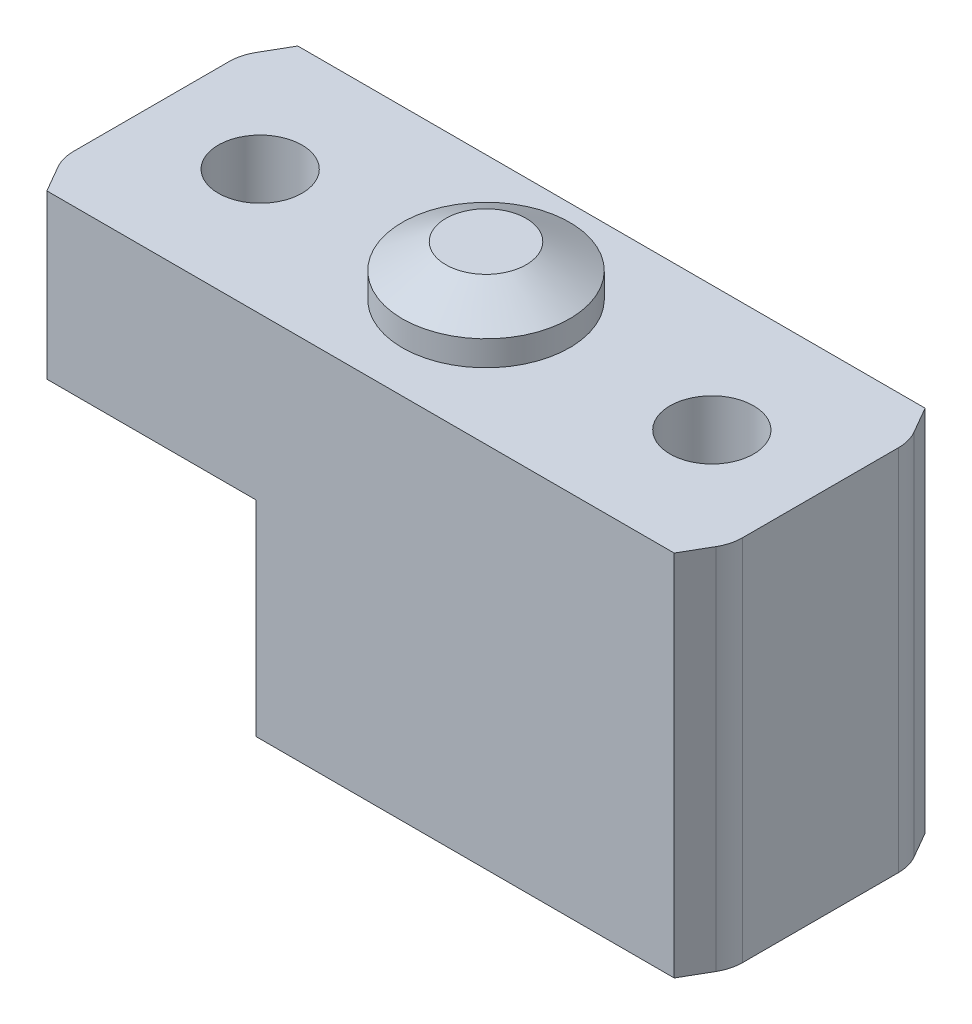
from build123d import *
from OCP.BRepFilletAPI import BRepFilletAPI_MakeChamfer
from build123d.topology import SkipClean

# Parameters (mm, degrees)
SKETCH1_W           = 8
SKETCH1_H           = 3
BOSS_EXTRUDE1_DEPTH = 2.2
SKETCH2_R           = 1
BOSS_EXTRUDE2_DEPTH = 0.6
SKETCH3_R           = 0.5
CUT_EXTRUDE1_DEPTH  = 2.5
SKETCH4_W           = 5.5
SKETCH4_H           = 3
BOSS_EXTRUDE3_DEPTH = 2.2
BOSS_EXTRUDE4_START = 0.6
SKETCH5_R           = 1
BOSS_EXTRUDE4_DEPTH = 0.6
CUT_EXTRUDE2_START  = -2.5
SKETCH6_R           = 0.5
CUT_EXTRUDE2_DEPTH  = 2.5
CHAMFER1_SIZE       = 0.25
CHAMFER1_SIZE2      = 0.433012702
FILLET1_R           = 0.5
CHAMFER2_SIZE       = 0.3
CHAMFER2_SIZE2      = 0.519615242


with BuildPart() as part:
    # Sketch1 → Boss-Extrude1 (new body)
    with BuildSketch(Plane(origin=(0, 0, 0), x_dir=(1, 0, 0), z_dir=(0, 1, 0))):
        with Locations((4, -1.5)):
            Rectangle(SKETCH1_W, SKETCH1_H)
    extrude(amount=BOSS_EXTRUDE1_DEPTH)

    # Sketch2 → Boss-Extrude2 (add)
    with BuildSketch(Plane(origin=(0, 2.2, 0), x_dir=(1, 0, 0), z_dir=(0, 1, 0))):
        with Locations(Location((4, -1.5, 0), (0, 0, 270))):
            Circle(SKETCH2_R)
    extrude(amount=BOSS_EXTRUDE2_DEPTH)

    # Sketch3 → Cut-Extrude1 (cut)
    with BuildSketch(Plane(origin=(0, 2.2, 0), x_dir=(1, 0, 0), z_dir=(0, 1, 0))):
        with Locations(Location((1.3, -1.5, 0), (0, 0, 270))):
            Circle(SKETCH3_R)
        with Locations(Location((6.7, -1.5, 0), (0, 0, 270))):
            Circle(SKETCH3_R)
    extrude(amount=-CUT_EXTRUDE1_DEPTH, mode=Mode.SUBTRACT)

    # Sketch4 → Boss-Extrude3 (add)
    with BuildSketch(Plane.XZ):
        with Locations((5.25, 1.5)):
            Rectangle(SKETCH4_W, SKETCH4_H)
    extrude(amount=BOSS_EXTRUDE3_DEPTH)

    # Sketch5 → Boss-Extrude4 (add)
    with BuildSketch(Plane.XZ.offset(2.2).offset(BOSS_EXTRUDE4_START)):
        with Locations(Location((4, 1.5, 0), (0, 0, 90))):
            Circle(SKETCH5_R)
    extrude(amount=-BOSS_EXTRUDE4_DEPTH)

    # Sketch6 → Cut-Extrude2 (cut)
    with SkipClean():  # the faces are left unmerged after this step: merging them gives an invalid solid
        with BuildSketch(Plane.XZ.offset(2.2).offset(CUT_EXTRUDE2_START)):
            with Locations(Location((6.7, 1.5, 0), (0, 0, 270))):
                Circle(SKETCH6_R)
        extrude(amount=CUT_EXTRUDE2_DEPTH, mode=Mode.SUBTRACT)

    # Chamfer1: one chamfer whose edges measure the first distance from different faces: ONE call of the kernel's chamfer builder (chamfer() names one face for all edges)
    chamfer1_edges_1 = [part.edges().sort_by_distance(p)[0] for p in [
        (1.25, 0, 0),
        (2.5, -1.1, 0),
        (0, 1.1, 0),
        (8, 0, 0),
    ]]
    chamfer1_side_1 = [part.faces().sort_by_distance(p)[0] for p in [
        (4.509259259, 0.203703704, 0),
    ]]
    chamfer1_edges_2 = [part.edges().sort_by_distance(p)[0] for p in [
        (2.5, -1.1, 3),
        (1.25, 0, 3),
        (8, 0, 3),
        (0, 1.1, 3),
    ]]
    chamfer1_side_2 = [part.faces().sort_by_distance(p)[0] for p in [
        (4.509259259, 0.203703704, 3),
    ]]
    chamfer1 = BRepFilletAPI_MakeChamfer(part.part.solid().wrapped)
    for e in chamfer1_edges_1:
        chamfer1.Add(CHAMFER1_SIZE, CHAMFER1_SIZE2, e.wrapped, chamfer1_side_1[0].wrapped)  # the first distance lies on this face
    for e in chamfer1_edges_2:
        chamfer1.Add(CHAMFER1_SIZE, CHAMFER1_SIZE2, e.wrapped, chamfer1_side_2[0].wrapped)  # the first distance lies on this face
    add(Compound.cast(chamfer1.Shape()), mode=Mode.REPLACE)

    # Fillet1
    fillet1_edges = [part.edges().sort_by_distance(p)[0] for p in [
        (8, 0, 2.566987298),
        (8, 0, 0.433012702),
        (2.5, -1.1, 2.566987298),
        (2.5, -1.1, 0.433012702),
        (1.25, 0, 2.566987298),
        (1.25, 0, 0.433012702),
        (0, 1.1, 2.566987298),
        (0, 1.1, 0.433012702),
    ]]
    fillet(fillet1_edges, radius=FILLET1_R)

    # Chamfer2: one chamfer whose edges measure the first distance from different faces: ONE call of the kernel's chamfer builder (chamfer() names one face for all edges)
    chamfer2_edges_1 = [part.edges().sort_by_distance(p)[0] for p in [
        (4, 2.8, 0.5),
    ]]
    chamfer2_side_1 = [part.faces().sort_by_distance(p)[0] for p in [
        (4, 2.5, 0.5),
    ]]
    chamfer2_edges_2 = [part.edges().sort_by_distance(p)[0] for p in [
        (4, -2.8, 0.5),
    ]]
    chamfer2_side_2 = [part.faces().sort_by_distance(p)[0] for p in [
        (4, -2.5, 0.5),
    ]]
    chamfer2 = BRepFilletAPI_MakeChamfer(part.part.solid().wrapped)
    for e in chamfer2_edges_1:
        chamfer2.Add(CHAMFER2_SIZE, CHAMFER2_SIZE2, e.wrapped, chamfer2_side_1[0].wrapped)  # the first distance lies on this face
    for e in chamfer2_edges_2:
        chamfer2.Add(CHAMFER2_SIZE, CHAMFER2_SIZE2, e.wrapped, chamfer2_side_2[0].wrapped)  # the first distance lies on this face
    add(Compound.cast(chamfer2.Shape()), mode=Mode.REPLACE)


solid = part.part
